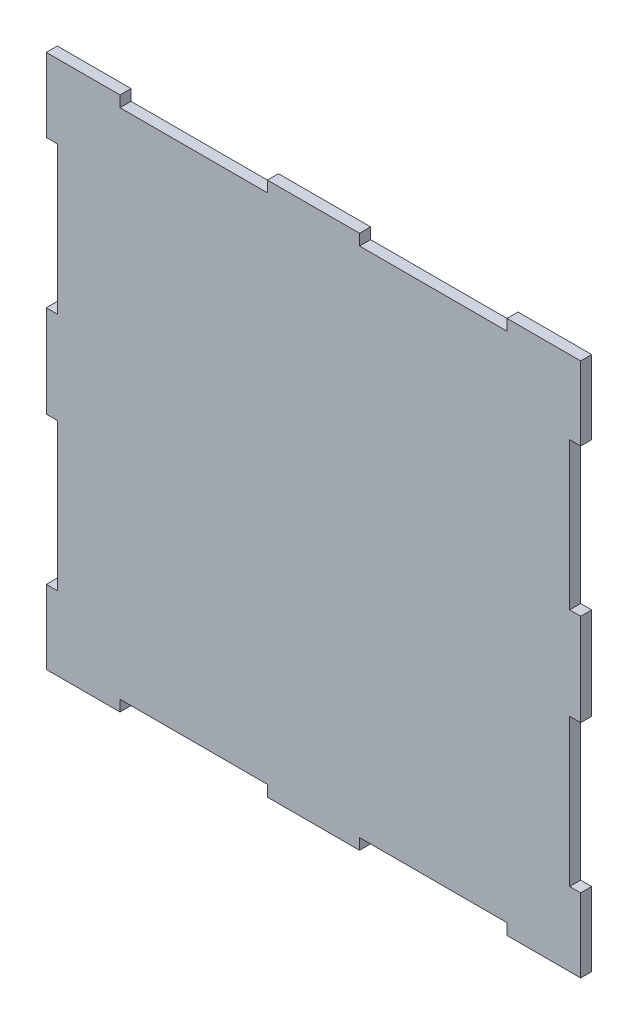
from build123d import *

# Parameters (mm, degrees)
SKETCH1_W             = 145
SKETCH1_H             = 145
BOSS_EXTRUDE179_DEPTH = 3
SKETCH2_W             = 40
SKETCH2_H             = 3
SKETCH2_W_2           = 3
SKETCH2_H_2           = 40
CUT_EXTRUDE1_DEPTH    = 3


with BuildPart() as part:
    # Sketch1 → Boss-Extrude179 (new body)
    with BuildSketch(Plane.XY):
        Rectangle(SKETCH1_W, SKETCH1_H)
    extrude(amount=BOSS_EXTRUDE179_DEPTH)

    # Sketch2 → Cut-Extrude1 (cut)
    with BuildSketch(Plane.XY.offset(3)):
        with Locations((-32.5, 71)):
            Rectangle(SKETCH2_W, SKETCH2_H)
        with Locations((32.5, 71)):
            Rectangle(SKETCH2_W, SKETCH2_H)
        with Locations((-71, 32.5)):
            Rectangle(SKETCH2_W_2, SKETCH2_H_2)
        with Locations((-71, -32.5)):
            Rectangle(SKETCH2_W_2, SKETCH2_H_2)
        with Locations((32.5, -71)):
            Rectangle(SKETCH2_W, SKETCH2_H)
        with Locations((-32.5, -71)):
            Rectangle(SKETCH2_W, SKETCH2_H)
        with Locations((71, -32.5)):
            Rectangle(SKETCH2_W_2, SKETCH2_H_2)
        with Locations((71, 32.5)):
            Rectangle(SKETCH2_W_2, SKETCH2_H_2)
    extrude(amount=-CUT_EXTRUDE1_DEPTH, mode=Mode.SUBTRACT)


solid = part.part
